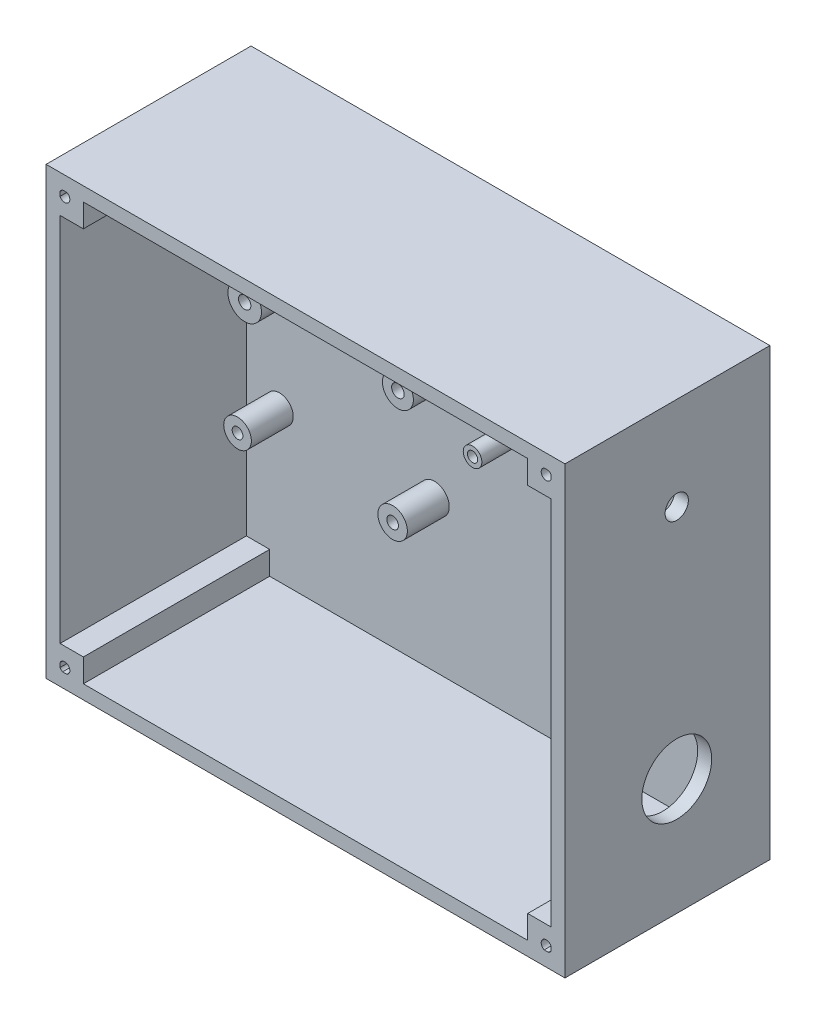
from build123d import *

# Parameters (mm, degrees)
SKETCH1_W           = 141.478
SKETCH1_H           = 121.412
BOSS_EXTRUDE1_DEPTH = 5.08
SKETCH2_W           = 141.478
SKETCH2_H           = 121.412
SKETCH2_W_2         = 133.858
SKETCH2_H_2         = 113.792
BOSS_EXTRUDE2_DEPTH = 50.8
SKETCH3_W           = 10.16
SKETCH3_H           = 10.16
SKETCH3_R           = 1.397
BOSS_EXTRUDE3_DEPTH = 50.8
SKETCH4_R           = 9.525
CUT_EXTRUDE1_DEPTH  = 50.8
SKETCH5_R           = 3.175
CUT_EXTRUDE2_DEPTH  = 50.8
SKETCH6_R           = 5.352500138
SKETCH6_R_2         = 1.742129358
SKETCH6_R_3         = 4.222417447
SKETCH6_R_4         = 1.7145
SKETCH6_R_5         = 4.579780215
SKETCH6_R_6         = 1.684043279
SKETCH6_R_7         = 3.988290748
SKETCH6_R_8         = 1.731852199
SKETCH6_R_9         = 4.015615957
SKETCH6_R_10        = 1.588571248
SKETCH6_R_11        = 3.768246572
SKETCH6_R_12        = 1.460999264
SKETCH6_R_13        = 2.921
SKETCH6_R_14        = 1.397
SKETCH6_R_15        = 2.54
BOSS_EXTRUDE4_DEPTH = 11.43


with BuildPart() as part:
    # Sketch1 → Boss-Extrude1 (new body)
    with BuildSketch(Plane.XY):
        with Locations((70.739, 60.706)):
            Rectangle(SKETCH1_W, SKETCH1_H)
    extrude(amount=BOSS_EXTRUDE1_DEPTH)

    # Sketch2 → Boss-Extrude2 (add)
    with BuildSketch(Plane.XY.offset(5.08)):
        with Locations((70.739, 60.706)):
            Rectangle(SKETCH2_W, SKETCH2_H)
        with Locations((70.739, 60.706)):
            Rectangle(SKETCH2_W_2, SKETCH2_H_2, mode=Mode.SUBTRACT)
    extrude(amount=BOSS_EXTRUDE2_DEPTH)

    # Sketch3 → Boss-Extrude3 (add)
    # profile 1 of 4: a face of its own
    with BuildSketch(Plane.XY.offset(5.08)):
        with Locations((5.08, 116.332)):
            Rectangle(SKETCH3_W, SKETCH3_H)
        with Locations((5.08, 116.332)):
            Circle(SKETCH3_R, mode=Mode.SUBTRACT)
    # profile 2 of 4: a face of its own
    with BuildSketch(Plane.XY.offset(5.08)):
        with Locations((5.08, 5.08)):
            Rectangle(SKETCH3_W, SKETCH3_H)
        with Locations((5.08, 5.08)):
            Circle(SKETCH3_R, mode=Mode.SUBTRACT)
    # profile 3 of 4: a face of its own
    with BuildSketch(Plane.XY.offset(5.08)):
        with Locations((136.398, 5.08)):
            Rectangle(SKETCH3_W, SKETCH3_H)
        with Locations((136.398, 5.08)):
            Circle(SKETCH3_R, mode=Mode.SUBTRACT)
    # profile 4 of 4: a face of its own
    with BuildSketch(Plane.XY.offset(5.08)):
        with Locations((136.398, 116.332)):
            Rectangle(SKETCH3_W, SKETCH3_H)
        with Locations((136.398, 116.332)):
            Circle(SKETCH3_R, mode=Mode.SUBTRACT)
    extrude(amount=BOSS_EXTRUDE3_DEPTH)

    # Sketch4 → Cut-Extrude1 (cut)
    with BuildSketch(Plane(origin=(141.478, 0, 0), x_dir=(0, 0, -1), z_dir=(1, 0, 0))):
        with Locations((-25.4, 31.75)):
            Circle(SKETCH4_R)
    extrude(amount=-CUT_EXTRUDE1_DEPTH, mode=Mode.SUBTRACT)

    # Sketch5 → Cut-Extrude2 (cut)
    with BuildSketch(Plane(origin=(141.478, 0, 0), x_dir=(0, 0, -1), z_dir=(1, 0, 0))):
        with Locations((-25.4, 96.012)):
            Circle(SKETCH5_R)
    extrude(amount=-CUT_EXTRUDE2_DEPTH, mode=Mode.SUBTRACT)

    # Sketch6 → Boss-Extrude4 (add)
    # profile 1 of 9: a face of its own
    with BuildSketch(Plane.XY.offset(5.08)):
        with Locations(Location((56.555179335, 108.156736707, 0), (0, 0, 180))):
            Circle(SKETCH6_R)
        with Locations((56.555179335, 108.156736707)):
            Circle(SKETCH6_R_2, mode=Mode.SUBTRACT)
    # profile 2 of 9: a face of its own
    with BuildSketch(Plane.XY.offset(5.08)):
        with Locations(Location((56.555179335, 76.533736707, 0), (0, 0, 180))):
            Circle(SKETCH6_R_3)
        with Locations((56.555179335, 76.533736707)):
            Circle(SKETCH6_R_4, mode=Mode.SUBTRACT)
    # profile 3 of 9: a face of its own
    with BuildSketch(Plane.XY.offset(5.08)):
        with Locations(Location((14.772179335, 76.533736707, 0), (0, 0, 180))):
            Circle(SKETCH6_R_5)
        with Locations((14.772179335, 76.533736707)):
            Circle(SKETCH6_R_6, mode=Mode.SUBTRACT)
    # profile 4 of 9: a face of its own
    with BuildSketch(Plane.XY.offset(5.08)):
        with Locations(Location((14.772179335, 108.156736707, 0), (0, 0, 180))):
            Circle(SKETCH6_R_7)
        with Locations((14.772179335, 108.156736707)):
            Circle(SKETCH6_R_8, mode=Mode.SUBTRACT)
    # profile 5 of 9: a face of its own
    with BuildSketch(Plane.XY.offset(5.08)):
        with Locations(Location((55.116978912, 44.699028107, 0), (0, 0, 180))):
            Circle(SKETCH6_R_9)
        with Locations((55.116978912, 44.699028107)):
            Circle(SKETCH6_R_10, mode=Mode.SUBTRACT)
    # profile 6 of 9: a face of its own
    with BuildSketch(Plane.XY.offset(5.08)):
        with Locations(Location((12.825978912, 44.699028107, 0), (0, 0, 180))):
            Circle(SKETCH6_R_11)
        with Locations((12.825978912, 44.699028107)):
            Circle(SKETCH6_R_12, mode=Mode.SUBTRACT)
    # profile 7 of 9: a face of its own
    with BuildSketch(Plane.XY.offset(5.08)):
        with Locations(Location((114.503593068, 107.959774234, 0), (0, 0, 180))):
            Circle(SKETCH6_R_13)
        with Locations((114.503593068, 107.959774234)):
            Circle(SKETCH6_R_14, mode=Mode.SUBTRACT)
    # profile 8 of 9: a face of its own
    with BuildSketch(Plane.XY.offset(5.08)):
        with Locations(Location((76.911593068, 71.129774234, 0), (0, 0, 180))):
            Circle(SKETCH6_R_15)
        with Locations((76.911593068, 71.129774234)):
            Circle(SKETCH6_R_14, mode=Mode.SUBTRACT)
    # profile 9 of 9: a face of its own
    with BuildSketch(Plane.XY.offset(5.08)):
        with Locations(Location((77.673593068, 107.959774234, 0), (0, 0, 180))):
            Circle(SKETCH6_R_13)
        with Locations((77.673593068, 107.959774234)):
            Circle(SKETCH6_R_14, mode=Mode.SUBTRACT)
    extrude(amount=BOSS_EXTRUDE4_DEPTH)


solid = part.part
